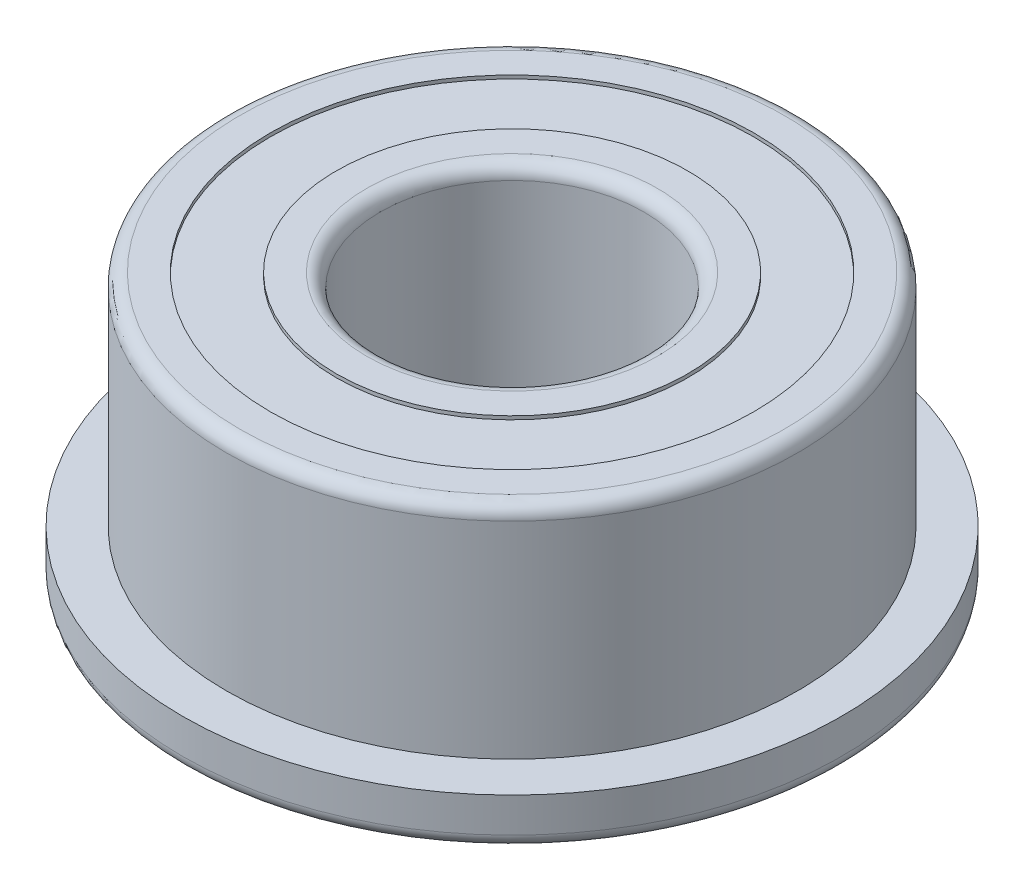
from build123d import *

# Parameters (mm, degrees)
SKETCH1_R           = 7.5
BOSS_EXTRUDE1_DEPTH = 1.1
SKETCH2_R           = 6.5
BOSS_EXTRUDE2_DEPTH = 5
SKETCH3_R           = 3
CUT_EXTRUDE1_DEPTH  = 13.235603786
SKETCH4_R           = 6.5
SKETCH4_R_2         = 4
CUT_EXTRUDE2_DEPTH  = 0.08
CUT_EXTRUDE3_START  = -0.08
SKETCH5_R           = 5.5
SKETCH5_R_2         = 4
CUT_EXTRUDE3_DEPTH  = 0.08
FILLET1_R           = 0.31


with BuildPart() as part:
    # Sketch1 → Boss-Extrude1 (new body)
    with BuildSketch(Plane(origin=(0, 0, 0), x_dir=(1, 0, 0), z_dir=(0, 1, 0))):
        with Locations(Location((0, 0, 0), (0, 0, 270))):
            Circle(SKETCH1_R)
    extrude(amount=BOSS_EXTRUDE1_DEPTH)

    # Sketch2 → Boss-Extrude2 (add)
    with BuildSketch(Plane(origin=(0, 1.1, 0), x_dir=(1, 0, 0), z_dir=(0, 1, 0))):
        with Locations(Location((0, 0, 0), (0, 0, 270))):
            Circle(SKETCH2_R)
    extrude(amount=BOSS_EXTRUDE2_DEPTH)

    # Sketch3 → Cut-Extrude1 (cut, through all)
    with BuildSketch(Plane(origin=(0, 6.1, 0), x_dir=(1, 0, 0), z_dir=(0, 1, 0))):
        with Locations(Location((0, 0, 0), (0, 0, 270))):
            Circle(SKETCH3_R)
    extrude(amount=-CUT_EXTRUDE1_DEPTH, mode=Mode.SUBTRACT)

    # Sketch4 → Cut-Extrude2 (cut)
    with BuildSketch(Plane.XZ):
        with Locations(Location((0, 0, 0), (0, 0, 90))):
            Circle(SKETCH4_R)
        with Locations(Location((0, 0, 0), (0, 0, 270))):
            Circle(SKETCH4_R_2, mode=Mode.SUBTRACT)
    extrude(amount=-CUT_EXTRUDE2_DEPTH, mode=Mode.SUBTRACT)

    # Sketch5 → Cut-Extrude3 (cut)
    with BuildSketch(Plane(origin=(0, 6.1, 0), x_dir=(1, 0, 0), z_dir=(0, 1, 0)).offset(CUT_EXTRUDE3_START)):
        with Locations(Location((0, 0, 0), (0, 0, 270))):
            Circle(SKETCH5_R)
        with Locations(Location((0, 0, 0), (0, 0, 90))):
            Circle(SKETCH5_R_2, mode=Mode.SUBTRACT)
    extrude(amount=CUT_EXTRUDE3_DEPTH, mode=Mode.SUBTRACT)

    # Fillet1
    fillet1_edges = [part.edges().sort_by_distance(p)[0] for p in [
        (0, 0, -3),
        (0, 6.1, -3),
        (0, 0, -7.5),
        (0, 6.1, -6.5),
    ]]
    fillet(fillet1_edges, radius=FILLET1_R)


solid = part.part
